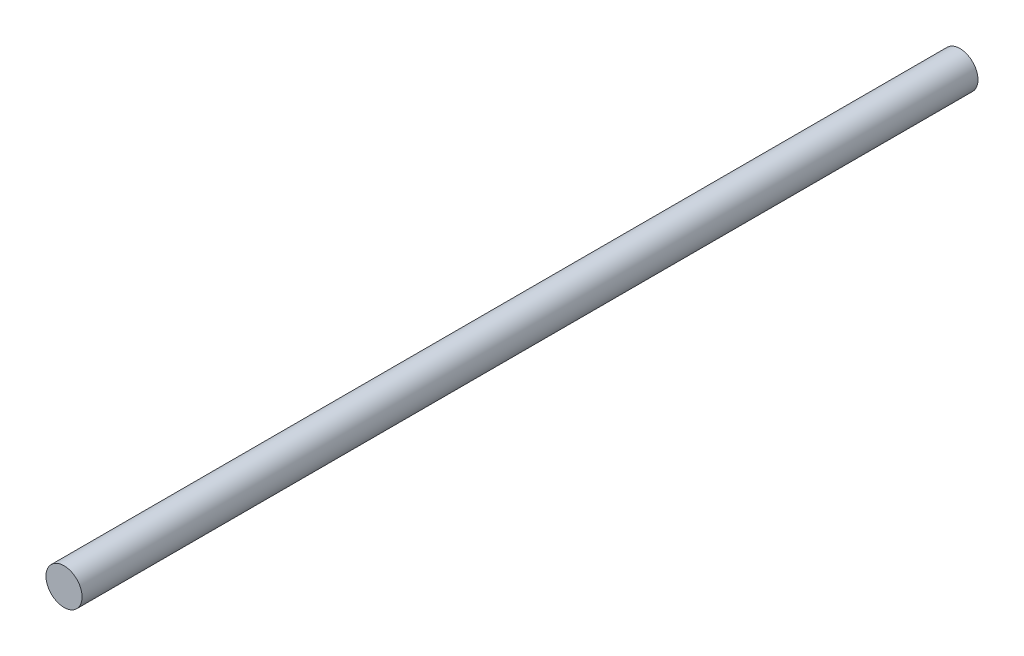
from build123d import *

# Parameters (mm, degrees)
SKETCH1_R           = 3.175
BOSS_EXTRUDE1_DEPTH = 157.48


with BuildPart() as part:
    # Sketch1 → Boss-Extrude1 (new body)
    with BuildSketch(Plane.XY):
        Circle(SKETCH1_R)
    extrude(amount=BOSS_EXTRUDE1_DEPTH)


solid = part.part
